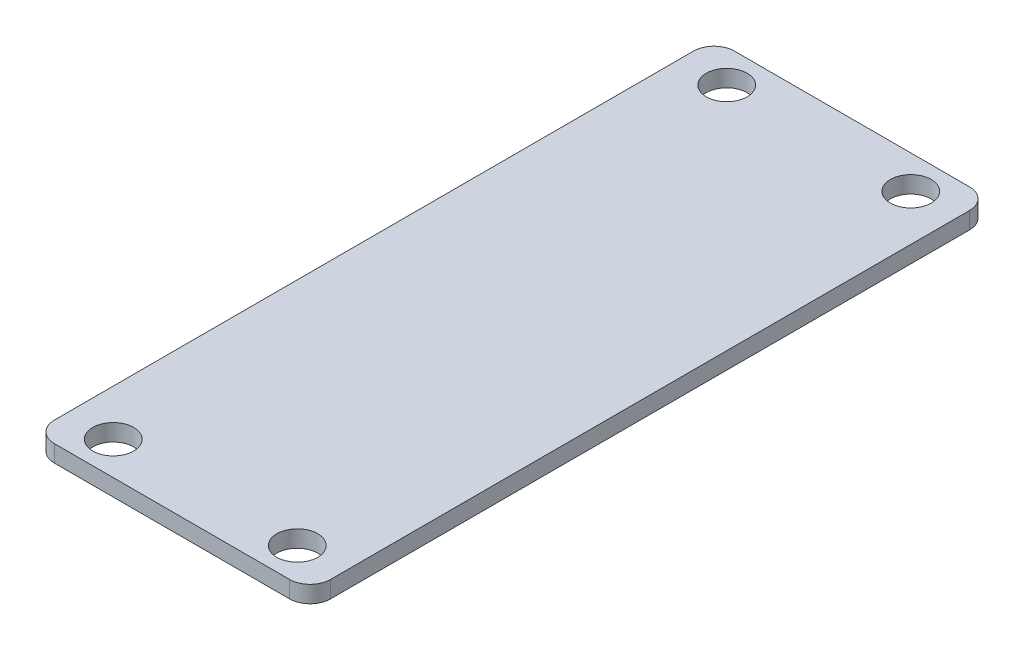
from build123d import *

# Parameters (mm, degrees)
SKETCH1_W           = 27
SKETCH1_H           = 66.5
BOSS_EXTRUDE1_DEPTH = 1.65
FILLET1_R           = 2
SKETCH2_R           = 2
CUT_EXTRUDE1_DEPTH  = 36.924017036


with BuildPart() as part:
    # Sketch1 → Boss-Extrude1 (new body)
    with BuildSketch(Plane(origin=(0, 0, 0), x_dir=(1, 0, 0), z_dir=(0, 1, 0))):
        Rectangle(SKETCH1_W, SKETCH1_H)
    extrude(amount=BOSS_EXTRUDE1_DEPTH)

    # Fillet1
    fillet1_edges = [part.edges().sort_by_distance(p)[0] for p in [
        (-13.5, 0.825, -33.25),
        (13.5, 0.825, -33.25),
        (13.5, 0.825, 33.25),
        (-13.5, 0.825, 33.25),
    ]]
    fillet(fillet1_edges, radius=FILLET1_R)

    # Sketch2 → Cut-Extrude1 (cut, through all)
    with BuildSketch(Plane(origin=(0, 1.65, 0), x_dir=(1, 0, 0), z_dir=(0, 1, 0))):
        with Locations(Location((-9, 30, 0), (0, 0, 270))):
            Circle(SKETCH2_R)
        with Locations(Location((9, 30, 0), (0, 0, 270))):
            Circle(SKETCH2_R)
        with Locations(Location((9, -30, 0), (0, 0, 270))):
            Circle(SKETCH2_R)
        with Locations(Location((-9, -30, 0), (0, 0, 270))):
            Circle(SKETCH2_R)
    extrude(amount=-CUT_EXTRUDE1_DEPTH, mode=Mode.SUBTRACT)


solid = part.part
